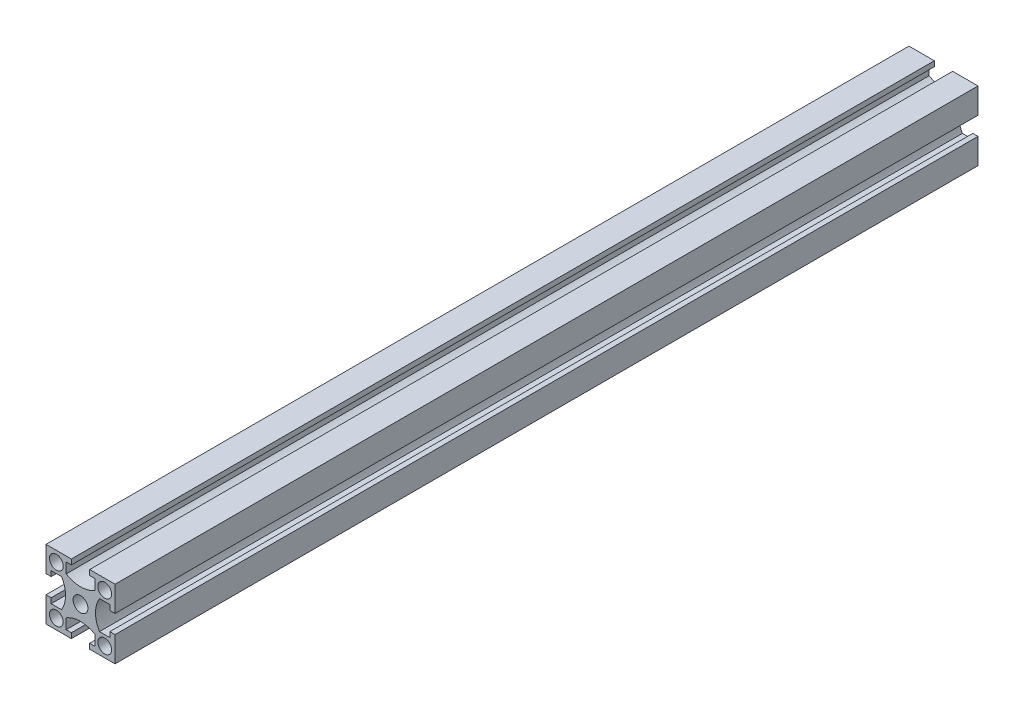
from build123d import *

# Parameters (mm, degrees)
SKETCH_1_W          = 20
SKETCH_1_H          = 20
EXTRUDE_1_DEPTH     = 250
SKETCH_2_R          = 2.15
SKETCH_2_R_2        = 2
CUT_EXTRUDE_1_DEPTH = 300


with BuildPart() as part:
    # 스케치1 → 보스-돌출1 (new body)
    with BuildSketch(Plane.XY):
        Rectangle(SKETCH_1_W, SKETCH_1_H)
    extrude(amount=EXTRUDE_1_DEPTH)

    # 스케치2 → 컷-돌출1 (cut)
    with BuildSketch(Plane.XY.offset(250)):
        Circle(SKETCH_2_R)
        with Locations((-7, 7)):
            Circle(SKETCH_2_R_2)
        with Locations((7, 7)):
            Circle(SKETCH_2_R_2)
        with Locations((7, -7)):
            Circle(SKETCH_2_R_2)
        with Locations((-7, -7)):
            Circle(SKETCH_2_R_2)
        with BuildLine():
            Line((-2.65, 10), (-2.65, 8.5))
            Line((-2.65, 8.5), (-4.15, 8.5))
            Line((-4.15, 8.5), (-4.15, 5.5))
            ThreePointArc((-4.15, 5.5), (0, 4.339407869), (4.15, 5.5))
            Line((4.15, 5.5), (4.15, 8.5))
            Line((4.15, 8.5), (2.65, 8.5))
            Line((2.65, 8.5), (2.65, 10))
            Line((2.65, 10), (-2.65, 10))
        make_face()
        with BuildLine():
            Line((10, 2.65), (8.5, 2.65))
            Line((8.5, 2.65), (8.5, 4.15))
            Line((8.5, 4.15), (5.5, 4.15))
            ThreePointArc((5.5, 4.15), (4.339407869, 0), (5.5, -4.15))
            Line((5.5, -4.15), (8.5, -4.15))
            Line((8.5, -4.15), (8.5, -2.65))
            Line((8.5, -2.65), (10, -2.65))
            Line((10, -2.65), (10, 2.65))
        make_face()
        with BuildLine():
            Line((2.65, -10), (2.65, -8.5))
            Line((2.65, -8.5), (4.15, -8.5))
            Line((4.15, -8.5), (4.15, -5.5))
            ThreePointArc((4.15, -5.5), (0, -4.339407869), (-4.15, -5.5))
            Line((-4.15, -5.5), (-4.15, -8.5))
            Line((-4.15, -8.5), (-2.65, -8.5))
            Line((-2.65, -8.5), (-2.65, -10))
            Line((-2.65, -10), (2.65, -10))
        make_face()
        with BuildLine():
            Line((-10, -2.65), (-8.5, -2.65))
            Line((-8.5, -2.65), (-8.5, -4.15))
            Line((-8.5, -4.15), (-5.5, -4.15))
            ThreePointArc((-5.5, -4.15), (-4.339407869, 0), (-5.5, 4.15))
            Line((-5.5, 4.15), (-8.5, 4.15))
            Line((-8.5, 4.15), (-8.5, 2.65))
            Line((-8.5, 2.65), (-10, 2.65))
            Line((-10, 2.65), (-10, -2.65))
        make_face()
    extrude(amount=-CUT_EXTRUDE_1_DEPTH, mode=Mode.SUBTRACT)


solid = part.part
